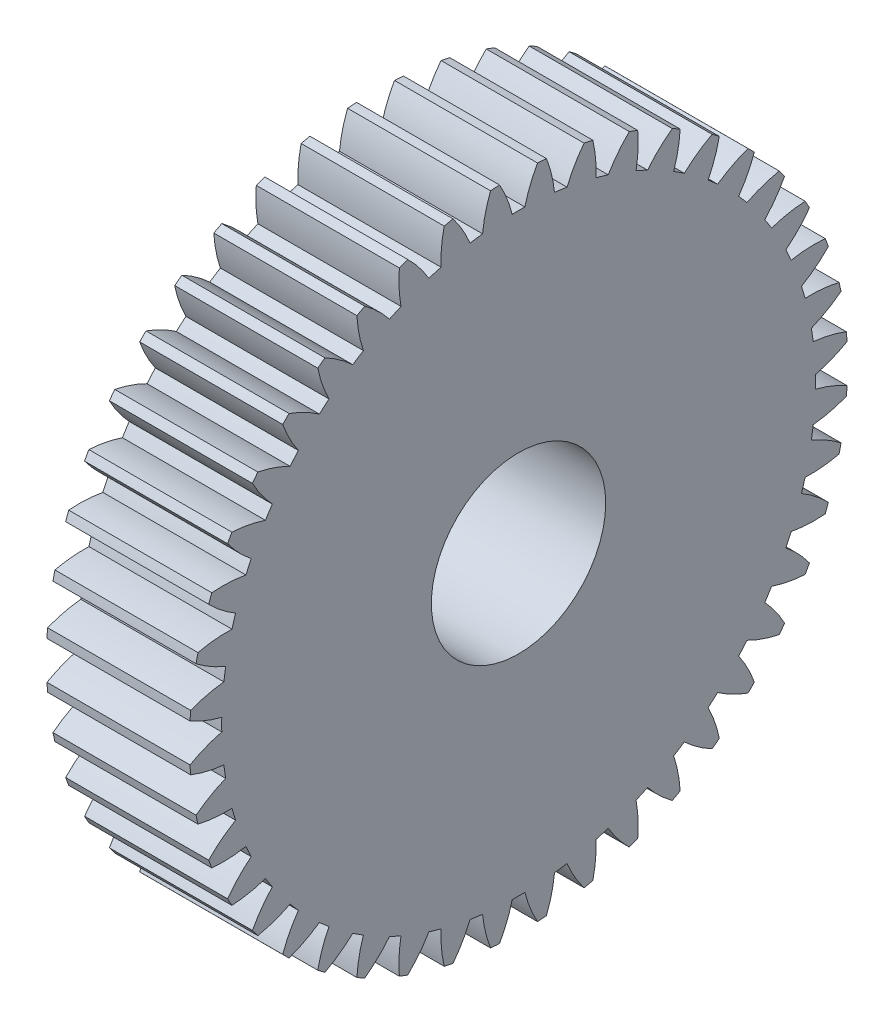
from build123d import *

# Parameters (mm, degrees)
BASPROSKE_W        = 4
BASPROSKE_H        = 9.2
TOOTHCUT_DEPTH     = 14.611759622
TEETHCUTS_COUNT    = 44
TEETHCUTS_ANGLE    = 351.818181818
BORSKE_R           = 0.5
BORE_DEPTH         = 50.0000508
SKETCH1_R          = 2.4375
CUT_EXTRUDE1_DEPTH = 14.591005124


with BuildPart() as part:
    # BasProSke → Base-Revolve (revolve)
    with BuildSketch(Plane(origin=(0, 0, 0), x_dir=(1, 0, 0), z_dir=(0, 1, 0)), mode=Mode.PRIVATE) as base_revolve_sk:
        with Locations((2, 4.6)):
            Rectangle(BASPROSKE_W, BASPROSKE_H)
    revolve(base_revolve_sk.sketch.rotate(Axis((-10, 0, 0), (1, 0, 0)), 180), axis=Axis((-10, 0, 0), (1, 0, 0)))

    # TooCutSke → ToothCut (cut, through all)
    with BuildSketch(Plane(origin=(0, 0, 0), x_dir=(0, 0, -1), z_dir=(1, 0, 0))):
        with BuildLine():
            ThreePointArc((0.177003636, 8.297112191), (0, 8.299), (-0.177003636, 8.297112191))
            ThreePointArc((-0.177003636, 8.297112191), (-0.329182518, 8.766121098), (-0.545405548, 9.209263703))
            ThreePointArc((-0.545405548, 9.209263703), (0, 9.2254), (0.545405548, 9.209263703))
            ThreePointArc((0.545405548, 9.209263703), (0.329182518, 8.766121098), (0.177003636, 8.297112191))
        make_face()
    toothcut = extrude(amount=TOOTHCUT_DEPTH, mode=Mode.SUBTRACT)

    # TeethCuts: ToothCut ×44 about axis
    teethcuts_axis = Axis((-10, 0, 0), (1, 0, 0))
    for i in range(1, TEETHCUTS_COUNT):
        add(toothcut.rotate(teethcuts_axis, i * TEETHCUTS_ANGLE / (TEETHCUTS_COUNT - 1)), mode=Mode.SUBTRACT)

    # BorSke → Bore (cut, symmetric)
    with BuildSketch(Plane(origin=(0, 0, 0), x_dir=(0, 0, -1), z_dir=(1, 0, 0))):
        with Locations(Location((0, 0, 0), (0, 0, 180))):
            Circle(BORSKE_R)
    extrude(amount=BORE_DEPTH, both=True, mode=Mode.SUBTRACT)

    # Sketch1 → Cut-Extrude1 (cut, through all)
    with BuildSketch(Plane(origin=(4, 0, 0), x_dir=(0, 0, -1), z_dir=(1, 0, 0))):
        Circle(SKETCH1_R)
    extrude(amount=-CUT_EXTRUDE1_DEPTH, mode=Mode.SUBTRACT)


solid = part.part
